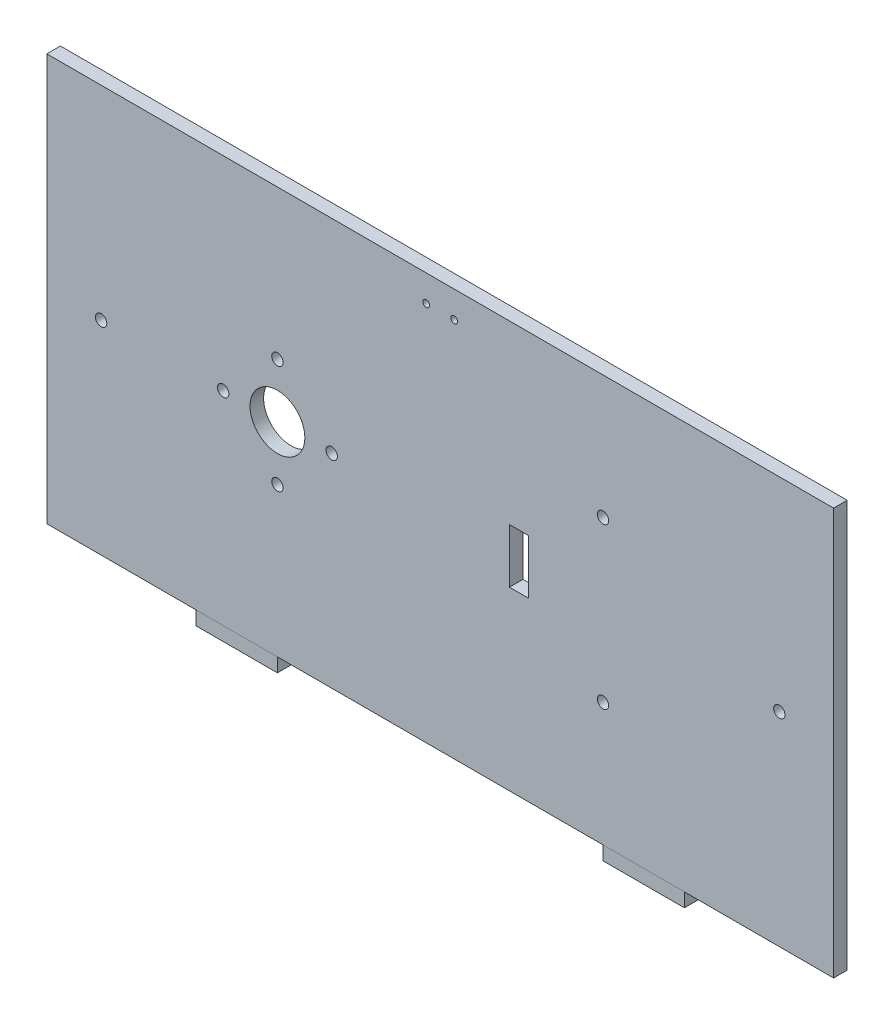
from build123d import *

# Parameters (mm, degrees)
SKETCH1_W             = 290
SKETCH1_H             = 150
BOSS_EXTRUDE1_DEPTH   = 5
CUT_EXTRUDE1_DEPTH    = 5
SKETCH3_W             = 30
SKETCH3_H             = 5.1
BOSS_EXTRUDE2_DEPTH   = 5
BOSS_EXTRUDE2_2_DEPTH = 5
SKETCH4_R             = 2.1
CUT_EXTRUDE2_DEPTH    = 10
SKETCH5_R             = 10.1
CUT_EXTRUDE3_DEPTH    = 10
SKETCH6_R             = 2.1
CUT_EXTRUDE4_DEPTH    = 10
SKETCH7_R             = 2.1
CUT_EXTRUDE5_DEPTH    = 10
SKETCH8_W             = 7
SKETCH8_H             = 20
CUT_EXTRUDE6_DEPTH    = 10


with BuildPart() as part:
    # Sketch1 → Boss-Extrude1 (new body)
    with BuildSketch(Plane.XY):
        Rectangle(SKETCH1_W, SKETCH1_H)
    extrude(amount=BOSS_EXTRUDE1_DEPTH)

    # Sketch2 → Cut-Extrude1 (cut)
    with BuildSketch(Plane.XY.offset(5)):
        with BuildLine():
            Line((-6.4, 65.2), (-5.15, 65.2))
            Line((-5.15, 65.2), (-3.9, 65.2))
            ThreePointArc((-3.9, 65.2), (-5.15, 66.45), (-6.4, 65.2))
        make_face()
        with BuildLine():
            Line((-3.9, 65.2), (-5.15, 65.2))
            Line((-5.15, 65.2), (-6.4, 65.2))
            ThreePointArc((-6.4, 65.2), (-5.15, 63.95), (-3.9, 65.2))
        make_face()
        with BuildLine():
            ThreePointArc((6.4, 65.2), (5.15, 66.45), (3.9, 65.2))
            Line((3.9, 65.2), (5.15, 65.2))
            Line((5.15, 65.2), (6.4, 65.2))
        make_face()
        with BuildLine():
            Line((5.15, 65.2), (3.9, 65.2))
            ThreePointArc((3.9, 65.2), (5.15, 63.95), (6.4, 65.2))
            Line((6.4, 65.2), (5.15, 65.2))
        make_face()
    extrude(amount=-CUT_EXTRUDE1_DEPTH, mode=Mode.SUBTRACT)

    # Sketch4 → Cut-Extrude2 (cut)
    with BuildSketch(Plane(origin=(0, 0, 0), x_dir=(-1, 0, 0), z_dir=(0, 0, -1))):
        with Locations((-125, 0)):
            Circle(SKETCH4_R)
        with Locations(Location((125, 0, 0), (0, 0, 180))):
            Circle(SKETCH4_R)
    extrude(amount=-CUT_EXTRUDE2_DEPTH, mode=Mode.SUBTRACT)

    # Sketch5 → Cut-Extrude3 (cut)
    with BuildSketch(Plane(origin=(0, 0, 0), x_dir=(-1, 0, 0), z_dir=(0, 0, -1))):
        with Locations((60, 0)):
            Circle(SKETCH5_R)
    extrude(amount=-CUT_EXTRUDE3_DEPTH, mode=Mode.SUBTRACT)

    # Sketch6 → Cut-Extrude4 (cut)
    with BuildSketch(Plane(origin=(0, 0, 0), x_dir=(-1, 0, 0), z_dir=(0, 0, -1))):
        with Locations((-60, 29.5)):
            Circle(SKETCH6_R)
        with Locations((-60, -29.5)):
            Circle(SKETCH6_R)
    extrude(amount=-CUT_EXTRUDE4_DEPTH, mode=Mode.SUBTRACT)

    # Sketch7 → Cut-Extrude5 (cut)
    with BuildSketch(Plane(origin=(0, 0, 0), x_dir=(-1, 0, 0), z_dir=(0, 0, -1))):
        with Locations((60, 20)):
            Circle(SKETCH7_R)
        with Locations((80, 0)):
            Circle(SKETCH7_R)
        with Locations((60, -20)):
            Circle(SKETCH7_R)
        with Locations((40, 0)):
            Circle(SKETCH7_R)
    extrude(amount=-CUT_EXTRUDE5_DEPTH, mode=Mode.SUBTRACT)

    # Sketch8 → Cut-Extrude6 (cut)
    with BuildSketch(Plane(origin=(0, 0, 0), x_dir=(-1, 0, 0), z_dir=(0, 0, -1))):
        with Locations((-29, 0)):
            Rectangle(SKETCH8_W, SKETCH8_H)
    extrude(amount=-CUT_EXTRUDE6_DEPTH, mode=Mode.SUBTRACT)


with BuildPart() as body_2:
    # Sketch3 → Boss-Extrude2 (new body)
    with BuildSketch(Plane.XY.offset(5)):
        with Locations((-75, -77.55)):
            Rectangle(SKETCH3_W, SKETCH3_H)
    extrude(amount=-BOSS_EXTRUDE2_DEPTH)


with BuildPart() as body_3:
    # Sketch3 → Boss-Extrude2 2 (new body)
    with BuildSketch(Plane.XY.offset(5)):
        with Locations((75, -77.55)):
            Rectangle(SKETCH3_W, SKETCH3_H)
    extrude(amount=-BOSS_EXTRUDE2_2_DEPTH)


solid = Compound([part.part, body_2.part, body_3.part])
